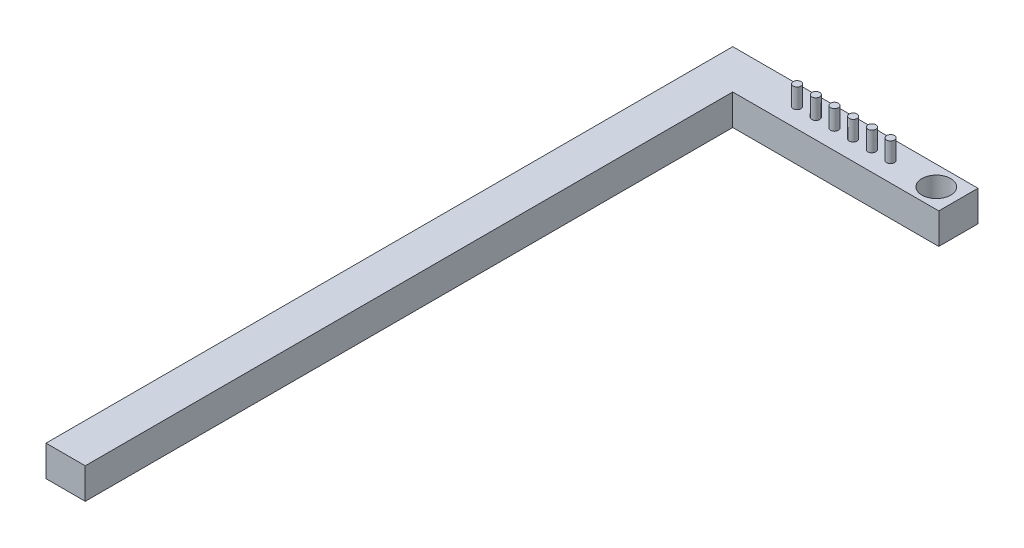
from build123d import *

# Parameters (mm, degrees)
SKETCH1_R           = 1.47
BOSS_EXTRUDE1_DEPTH = 3.14
SKETCH6_R           = 0.4
BOSS_EXTRUDE4_DEPTH = 2


with BuildPart() as part:
    # Sketch1 → Boss-Extrude1 (new body)
    with BuildSketch(Plane(origin=(0, 0, 0), x_dir=(1, 0, 0), z_dir=(0, 1, 0))):
        Polygon((12.5, 2), (12.5, -2), (-8.5, -2), (-8.5, -68), (-12.5, -68), (-12.5, 2), (-8.5, 2), align=None)
        with Locations(Location((10.25, 0, 0), (0, 0, 270))):
            Circle(SKETCH1_R, mode=Mode.SUBTRACT)
    extrude(amount=BOSS_EXTRUDE1_DEPTH)

    # Sketch6 → Boss-Extrude4 (add)
    with BuildSketch(Plane(origin=(0, 3.14, 0), x_dir=(1, 0, 0), z_dir=(0, 1, 0))):
        with Locations(Location((-3.935899676, -0.003030319, 0), (0, 0, 90))):
            Circle(SKETCH6_R)
        with Locations(Location((-2.03089972, -0.002623383, 0), (0, 0, 90))):
            Circle(SKETCH6_R)
        with Locations(Location((-0.125899763, -0.002216446, 0), (0, 0, 90))):
            Circle(SKETCH6_R)
        with Locations(Location((1.779100193, -0.00180951, 0), (0, 0, 90))):
            Circle(SKETCH6_R)
        with Locations(Location((3.68410015, -0.001402574, 0), (0, 0, 90))):
            Circle(SKETCH6_R)
        with Locations(Location((5.589100106, -0.000995637, 0), (0, 0, 90))):
            Circle(SKETCH6_R)
    extrude(amount=BOSS_EXTRUDE4_DEPTH)


solid = part.part
